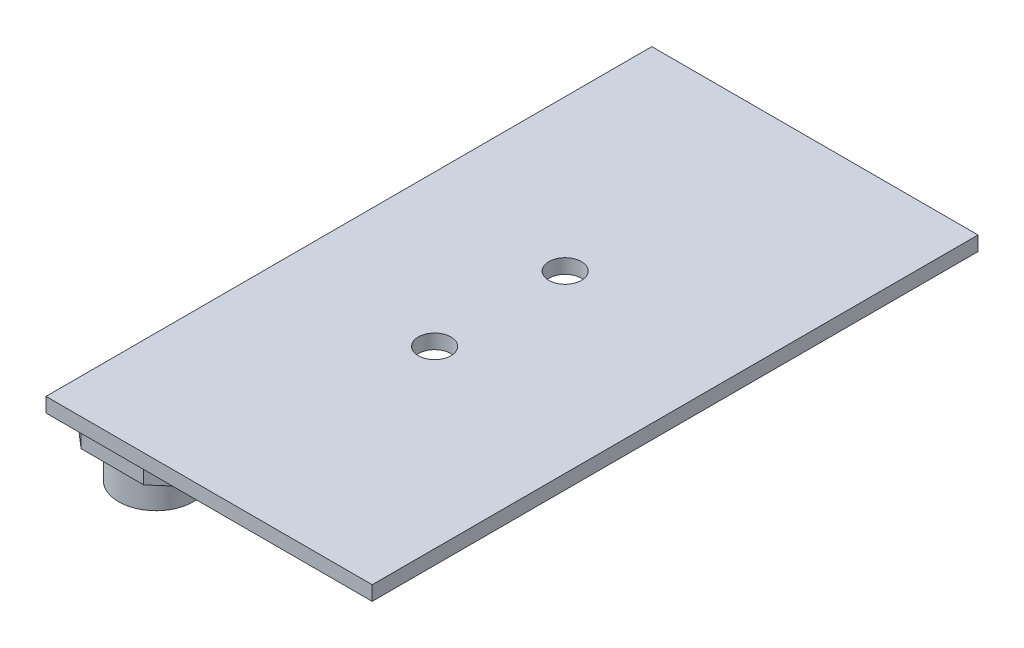
from build123d import *

# Parameters (mm, degrees)
SKETCH1_W           = 35
SKETCH1_H           = 65
BOSS_EXTRUDE1_DEPTH = 0.775
SKETCH2_R           = 1.75
CUT_EXTRUDE1_DEPTH  = 39.192309435
SKETCH3_W           = 7.4
SKETCH3_H           = 7.4
BOSS_EXTRUDE2_DEPTH = 3.55
BOSS_EXTRUDE3_DEPTH = 1.6
SKETCH5_R           = 4
BOSS_EXTRUDE4_DEPTH = 3.6


with BuildPart() as part:
    # Sketch1 → Boss-Extrude1 (new, symmetric)
    with BuildSketch(Plane(origin=(0, 0, 0), x_dir=(1, 0, 0), z_dir=(0, 1, 0))):
        with Locations((-2.5, 0)):
            Rectangle(SKETCH1_W, SKETCH1_H)
    extrude(amount=BOSS_EXTRUDE1_DEPTH, both=True)

    # Sketch2 → Cut-Extrude1 (cut, through all)
    with BuildSketch(Plane.XZ.offset(0.775)):
        with Locations(Location((-3.8, 7, 0), (0, 0, 270))):
            Circle(SKETCH2_R)
        with Locations(Location((-3.8, -7, 0), (0, 0, 270))):
            Circle(SKETCH2_R)
    extrude(amount=-CUT_EXTRUDE1_DEPTH, mode=Mode.SUBTRACT)


with BuildPart() as body_2:
    # Sketch3 → Boss-Extrude2 (new body)
    with BuildSketch(Plane.XZ.offset(0.775)):
        with Locations((-15.48, 15.63)):
            Rectangle(SKETCH3_W, SKETCH3_H)
    extrude(amount=BOSS_EXTRUDE2_DEPTH)


with BuildPart() as body_3:
    # Sketch4 → Boss-Extrude3 (new body)
    with BuildSketch(Plane.XZ.offset(0.775)):
        Polygon((-19.53, 29.62), (-19.53, 25.68), (-16.405, 22.97), (-9.685, 22.97), (-6.56, 25.68), (-6.56, 29.62), (-9.685, 32.33), (-16.405, 32.33), align=None)
    extrude(amount=BOSS_EXTRUDE3_DEPTH)

    # Sketch5 → Boss-Extrude4 (add)
    with BuildSketch(Plane.XZ.offset(2.375)):
        with Locations(Location((-13.045, 27.65, 0), (0, 0, 270))):
            Circle(SKETCH5_R)
    extrude(amount=BOSS_EXTRUDE4_DEPTH)


solid = Compound([part.part, body_2.part, body_3.part])
